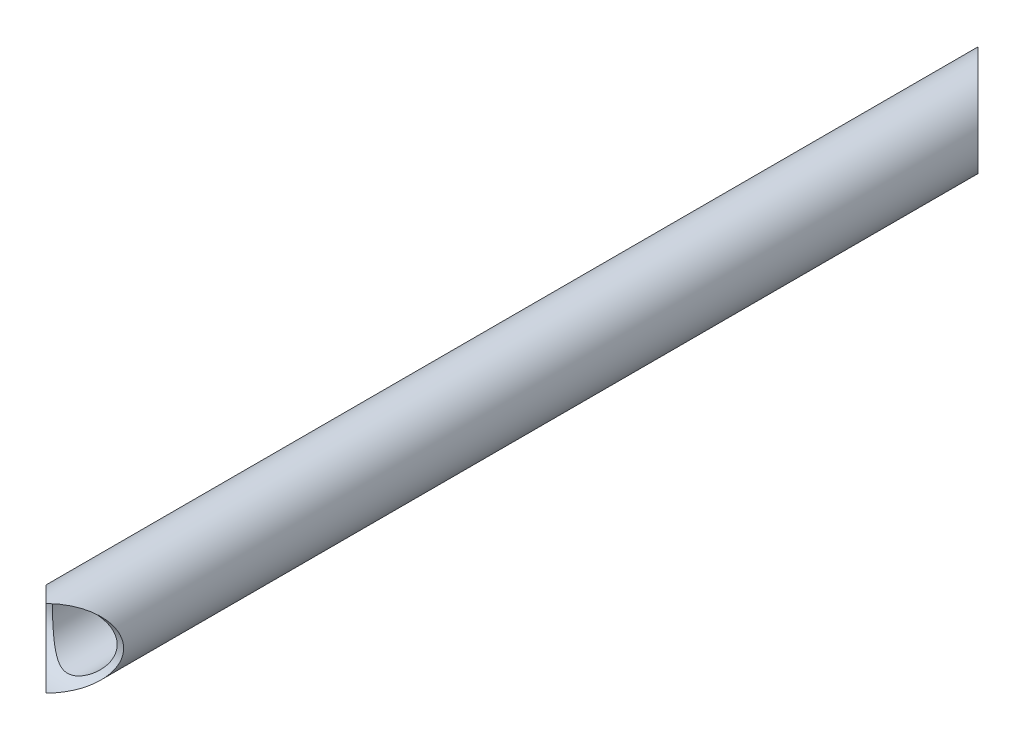
from build123d import *

# Parameters (mm, degrees)
SKETCH_2_R               = 15
SKETCH_3_R               = 12.5
CUT_EXTRUDE_1_DEPTH      = 376.599520766
CUT_EXTRUDE_2_DEPTH      = 376.599520766
CUT_EXTRUDE_2_DEPTH_BACK = 376.599520766
CUT_EXTRUDE_4_DEPTH      = 376.599520766
CUT_EXTRUDE_4_DEPTH_BACK = 376.599520766


with BuildPart() as part:
    # По траектории1: sweep along a path in Эскиз1
    with BuildLine(Plane(origin=(0, 0, 0), x_dir=(1, 0, 0), z_dir=(0, 1, 0))) as sweep_1_path:
        Line((0, 0), (0, -375))
    # Эскиз2 → По траектории1 (sweep)
    with BuildSketch(Plane.XY):
        Circle(SKETCH_2_R)
    sweep(path=sweep_1_path.line)

    # Эскиз3 → Вырез-Вытянуть1 (cut, through all)
    with BuildSketch(Plane.XY.offset(375)):
        Circle(SKETCH_3_R)
    extrude(amount=-CUT_EXTRUDE_1_DEPTH, mode=Mode.SUBTRACT)

    # Эскиз4 → Вырез-Вытянуть2 (cut, two sides: drawn at the far end of the back side and taken through both)
    with BuildSketch(Plane(origin=(0, 0, 0), x_dir=(1, 0, 0), z_dir=(0, 1, 0)).offset(-CUT_EXTRUDE_2_DEPTH_BACK)):
        Polygon((-15, 0), (15, -30), (15, 0), align=None)
    extrude(amount=CUT_EXTRUDE_2_DEPTH + CUT_EXTRUDE_2_DEPTH_BACK, mode=Mode.SUBTRACT)

    # Эскиз5 → Вырез-Вытянуть4 (cut, two sides: drawn at the far end of the back side and taken through both)
    with BuildSketch(Plane(origin=(0, 0, 0), x_dir=(0, 0, -1), z_dir=(1, 0, 0)).offset(-CUT_EXTRUDE_4_DEPTH_BACK)):
        with BuildLine():
            Line((-375, 15), (-375, -15))
            ThreePointArc((-375, -15), (-360, 0), (-375, 15))
        make_face()
    extrude(amount=CUT_EXTRUDE_4_DEPTH + CUT_EXTRUDE_4_DEPTH_BACK, mode=Mode.SUBTRACT)


solid = part.part
